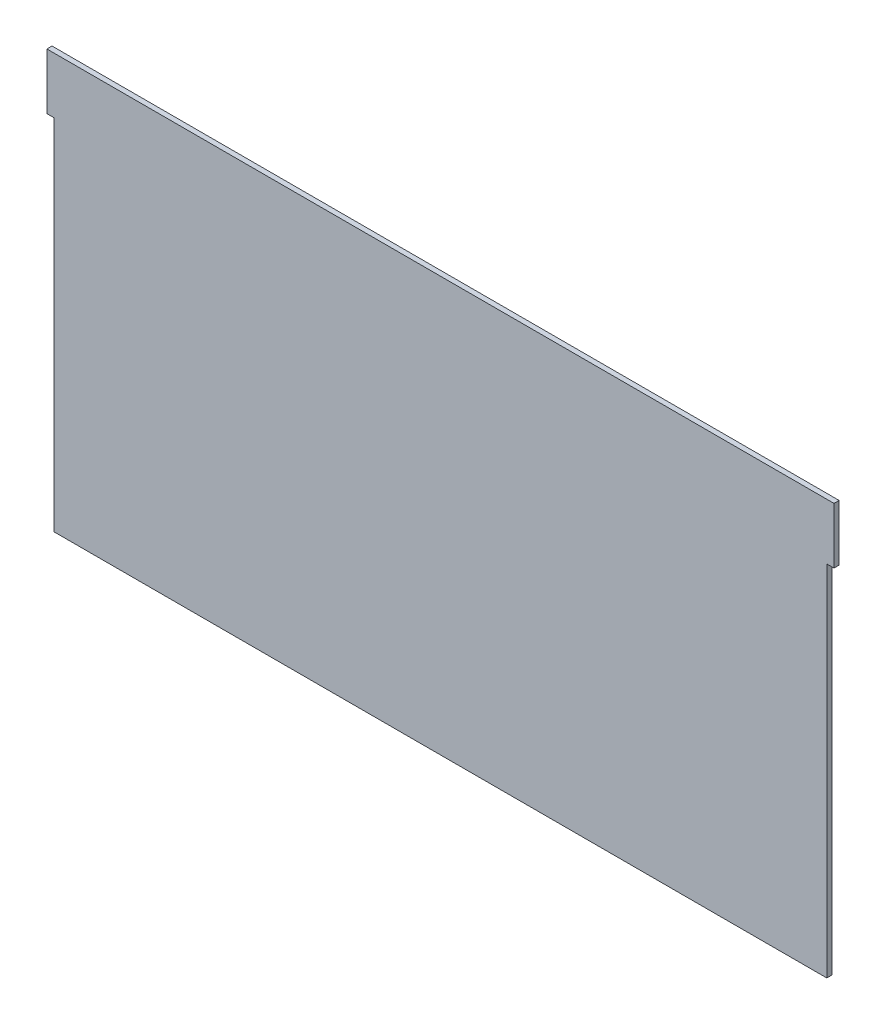
from build123d import *

# Parameters (mm, degrees)
SKETCH1_W           = 351.18034539
SKETCH1_H           = 184.999999
BOSS_EXTRUDE1_DEPTH = 2.286
SKETCH2_W           = 3.2
SKETCH2_H           = 160
CUT_EXTRUDE1_DEPTH  = 199.477667385


with BuildPart() as part:
    # Sketch1 → Boss-Extrude1 (new body)
    with BuildSketch(Plane.XY):
        Rectangle(SKETCH1_W, SKETCH1_H)
    extrude(amount=BOSS_EXTRUDE1_DEPTH)

    # Sketch2 → Cut-Extrude1 (cut, through all)
    with BuildSketch(Plane.XY.offset(2.286)):
        with Locations((-173.990172695, -12.4999995)):
            Rectangle(SKETCH2_W, SKETCH2_H)
        with Locations((173.990172695, -12.4999995)):
            Rectangle(SKETCH2_W, SKETCH2_H)
    extrude(amount=-CUT_EXTRUDE1_DEPTH, mode=Mode.SUBTRACT)


solid = part.part
